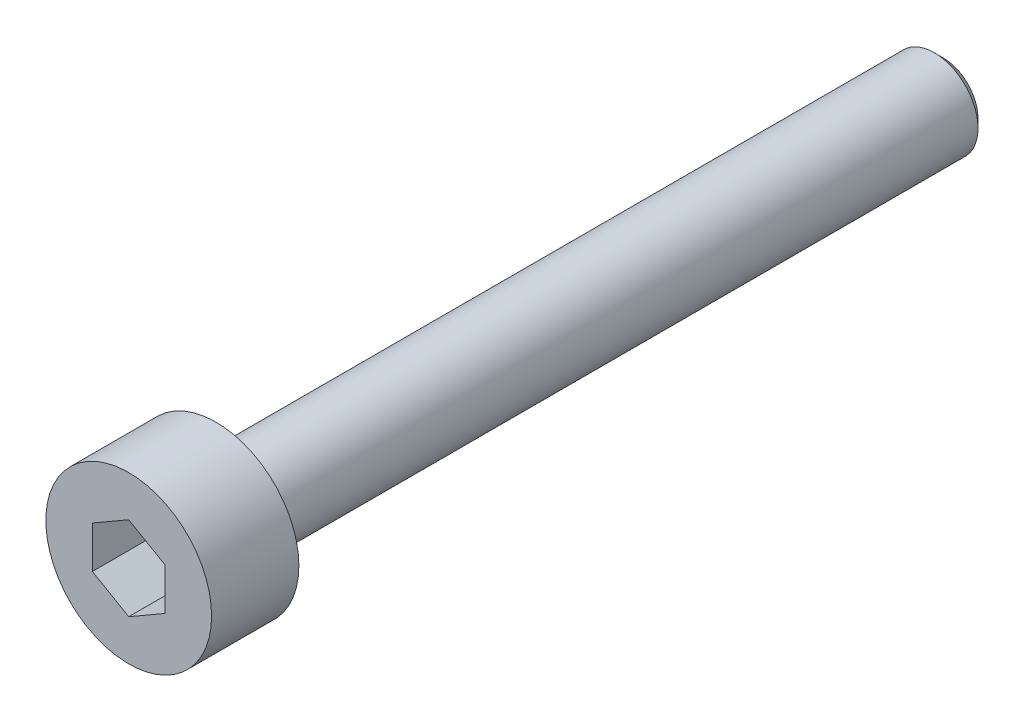
from build123d import *

# Parameters (mm, degrees)
SKETCH1_R           = 2.85
BOSS_EXTRUDE1_DEPTH = 3
SKETCH2_R           = 1.5
BOSS_EXTRUDE2_DEPTH = 25
CHAMFER1_SIZE       = 0.3
CUT_EXTRUDE1_DEPTH  = 2


with BuildPart() as part:
    # Sketch1 → Boss-Extrude1 (new body)
    with BuildSketch(Plane.XY):
        Circle(SKETCH1_R)
    extrude(amount=BOSS_EXTRUDE1_DEPTH)

    # Sketch2 → Boss-Extrude2 (add)
    with BuildSketch(Plane(origin=(0, 0, 0), x_dir=(-1, 0, 0), z_dir=(0, 0, -1))):
        with Locations(Location((0, 0, 0), (0, 0, 180))):
            Circle(SKETCH2_R)
    extrude(amount=BOSS_EXTRUDE2_DEPTH)

    # Chamfer1
    chamfer1_edges = [part.edges().sort_by_distance(p)[0] for p in [
        (-1.5, 0, -25),
    ]]
    chamfer(chamfer1_edges, length=CHAMFER1_SIZE)

    # Sketch3 → Cut-Extrude1 (cut)
    with BuildSketch(Plane.XY.offset(3)):
        Polygon((0, 1.443375673), (-1.25, 0.721687836), (-1.25, -0.721687836), (0, -1.443375673), (1.25, -0.721687836), (1.25, 0.721687836), align=None)
    extrude(amount=-CUT_EXTRUDE1_DEPTH, mode=Mode.SUBTRACT)


solid = part.part
